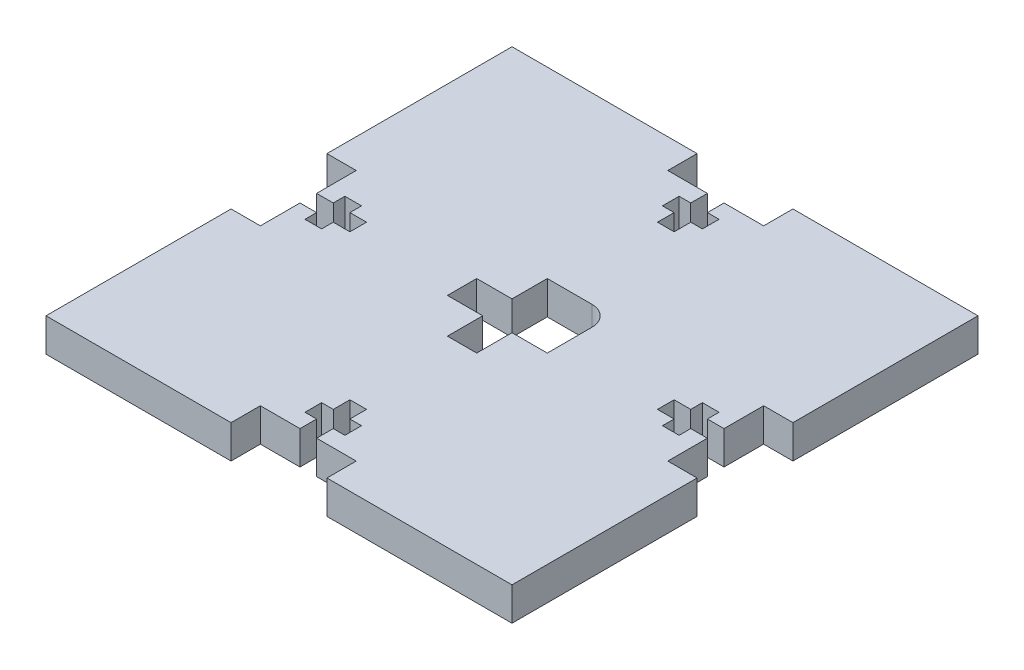
from build123d import *

# Parameters (mm, degrees)
SKETCH1_W           = 88.9
SKETCH1_H           = 88.9
BOSS_EXTRUDE1_DEPTH = 6.35
CUT_EXTRUDE3_DEPTH  = 126.88384527
SKETCH4_W           = 18.288
SKETCH4_H           = 5.588
SKETCH4_W_2         = 5.588
SKETCH4_H_2         = 18.288
CUT_EXTRUDE2_DEPTH  = 126.88384527
SKETCH7_W           = 6.731
SKETCH7_H           = 6.731
CUT_EXTRUDE4_DEPTH  = 126.88384527
FILLET1_R           = 3.81
CUT_EXTRUDE5_DEPTH  = 126.88384527


with BuildPart() as part:
    # Sketch1 → Boss-Extrude1 (new body)
    with BuildSketch(Plane(origin=(0, 0, 0), x_dir=(1, 0, 0), z_dir=(0, 1, 0))):
        with Locations((44.45, 44.45)):
            Rectangle(SKETCH1_W, SKETCH1_H)
    extrude(amount=BOSS_EXTRUDE1_DEPTH)

    # Sketch5 → Cut-Extrude3 (cut, through all)
    with BuildSketch(Plane(origin=(0, 6.35, 0), x_dir=(1, 0, 0), z_dir=(0, 1, 0))):
        Polygon((41.656, 47.244), (41.656, 53.975), (47.244, 53.975), (47.244, 47.244), (53.975, 47.244), (53.975, 41.656), (47.244, 41.656), (47.244, 34.925), (41.656, 34.925), (41.656, 41.656), (34.925, 41.656), (34.925, 47.244), align=None)
    extrude(amount=-CUT_EXTRUDE3_DEPTH, mode=Mode.SUBTRACT)

    # Sketch4 → Cut-Extrude2 (cut, through all)
    with BuildSketch(Plane(origin=(0, 6.35, 0), x_dir=(1, 0, 0), z_dir=(0, 1, 0))):
        with Locations((44.45, 86.106)):
            Rectangle(SKETCH4_W, SKETCH4_H)
        with Locations((86.106, 44.45)):
            Rectangle(SKETCH4_W_2, SKETCH4_H_2)
        with Locations((44.45, 2.794)):
            Rectangle(SKETCH4_W, SKETCH4_H)
        with Locations((2.794, 44.45)):
            Rectangle(SKETCH4_W_2, SKETCH4_H_2)
    extrude(amount=-CUT_EXTRUDE2_DEPTH, mode=Mode.SUBTRACT)

    # Sketch7 → Cut-Extrude4 (cut, through all)
    with BuildSketch(Plane(origin=(0, 6.35, 0), x_dir=(1, 0, 0), z_dir=(0, 1, 0))):
        with Locations((50.6095, 50.6095)):
            Rectangle(SKETCH7_W, SKETCH7_H)
    extrude(amount=-CUT_EXTRUDE4_DEPTH, mode=Mode.SUBTRACT)

    # Fillet1
    fillet1_edges = [part.edges().sort_by_distance(p)[0] for p in [
        (53.975, 3.175, -53.975),
    ]]
    fillet(fillet1_edges, radius=FILLET1_R)

    # Sketch8 → Cut-Extrude5 (cut, through all)
    with BuildSketch(Plane(origin=(0, 6.35, 0), x_dir=(1, 0, 0), z_dir=(0, 1, 0))):
        Polygon((5.588, 42.8625), (8.763, 42.8625), (8.763, 40.64), (11.938, 40.64), (11.938, 42.8625), (15.113, 42.8625), (15.113, 46.0375), (11.938, 46.0375), (11.938, 48.26), (8.763, 48.26), (8.763, 46.0375), (5.588, 46.0375), align=None)
        Polygon((42.8625, 83.312), (42.8625, 80.137), (40.64, 80.137), (40.64, 76.962), (42.8625, 76.962), (42.8625, 73.787), (46.0375, 73.787), (46.0375, 76.962), (48.26, 76.962), (48.26, 80.137), (46.0375, 80.137), (46.0375, 83.312), align=None)
        Polygon((83.312, 46.0375), (80.137, 46.0375), (80.137, 48.26), (76.962, 48.26), (76.962, 46.0375), (73.787, 46.0375), (73.787, 42.8625), (76.962, 42.8625), (76.962, 40.64), (80.137, 40.64), (80.137, 42.8625), (83.312, 42.8625), align=None)
        Polygon((46.0375, 5.588), (46.0375, 8.763), (48.26, 8.763), (48.26, 11.938), (46.0375, 11.938), (46.0375, 15.113), (42.8625, 15.113), (42.8625, 11.938), (40.64, 11.938), (40.64, 8.763), (42.8625, 8.763), (42.8625, 5.588), align=None)
    extrude(amount=-CUT_EXTRUDE5_DEPTH, mode=Mode.SUBTRACT)


solid = part.part
